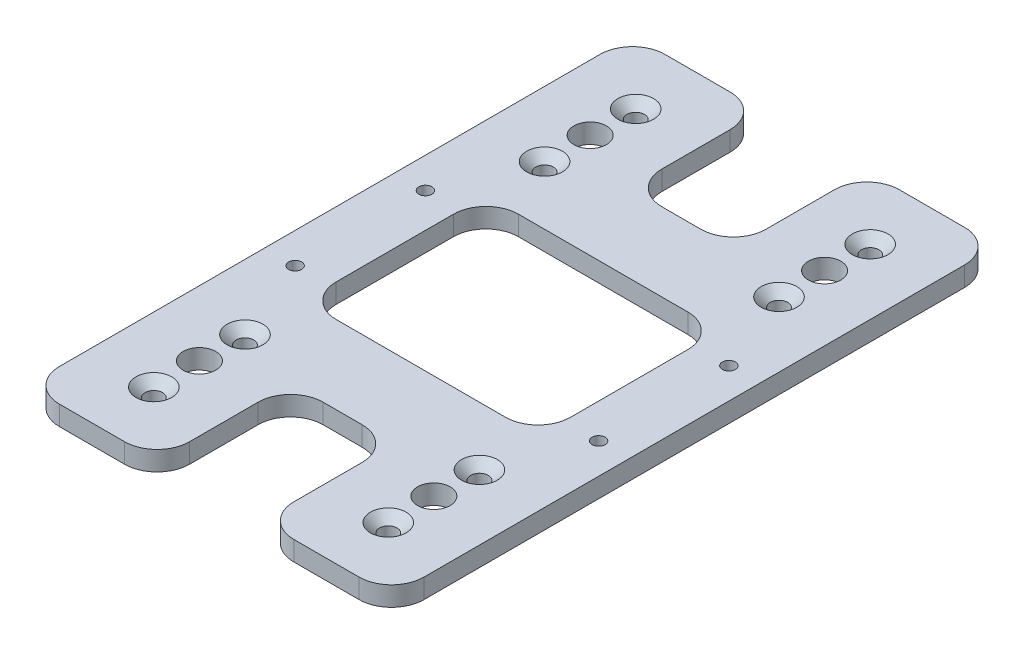
from build123d import *

# Parameters (mm, degrees)
BOSS_EXTRUDE1_DEPTH                                  = 3
FILLET1_R                                            = 5
CUT_EXTRUDE1_REACH                                   = 56.362
SKETCH5_W                                            = 36
SKETCH5_H                                            = 28
FILLET2_R                                            = 5
CSK_FOR_M2_5_COUNTERSUNK_FLAT_HEAD_SCREW_D           = 2.7
CSK_FOR_M2_5_COUNTERSUNK_FLAT_HEAD_SCREW_CSINK_D     = 5.5
CSK_FOR_M2_5_COUNTERSUNK_FLAT_HEAD_SCREW_CSINK_ANGLE = 90
CUT_EXTRUDE2_REACH                                   = 56.362
SKETCH3_R                                            = 2.5
MIRROR1_AT_THE_SECOND_PLANE_COPY_1_D                 = 2.7
MIRROR1_AT_THE_SECOND_PLANE_COPY_1_CSINK_D           = 5.5
MIRROR1_AT_THE_SECOND_PLANE_COPY_1_CSINK_ANGLE       = 90
MIRROR1_AT_THE_SECOND_PLANE_COPY_2_REACH             = 56.362
MIRROR1_AT_THE_SECOND_PLANE_COPY_2_SKETC_R           = 2.5
CUT_EXTRUDE3_REACH                                   = 56.362
SKETCH7_R                                            = 1
MIRROR2_AT_THE_SECOND_PLANE_COPY_1_REACH             = 56.362
MIRROR2_AT_THE_SECOND_PLANE_COPY_1_SKETC_R           = 1


with BuildPart() as part:
    # Sketch1 → Boss-Extrude1 (new body)
    with BuildSketch(Plane(origin=(0, 0, 0), x_dir=(1, 0, 0), z_dir=(0, 1, 0))):
        Polygon((8, 26), (-8, 26), (-8, 46.5), (-28, 46.5), (-28, -46.5), (-8, -46.5), (-8, -26), (8, -26), (8, -46.5), (28, -46.5), (28, 46.5), (8, 46.5), align=None)
    extrude(amount=BOSS_EXTRUDE1_DEPTH)

    # Fillet1
    fillet1_edges = [part.edges().sort_by_distance(p)[0] for p in [
        (-8, 1.5, -26),
        (8, 1.5, -26),
        (8, 1.5, -46.5),
        (28, 1.5, -46.5),
        (28, 1.5, 46.5),
        (8, 1.5, 46.5),
        (8, 1.5, 26),
        (-8, 1.5, 26),
        (-8, 1.5, 46.5),
        (-28, 1.5, 46.5),
        (-28, 1.5, -46.5),
        (-8, 1.5, -46.5),
    ]]
    fillet(fillet1_edges, radius=FILLET1_R)

    # Sketch5 → Cut-Extrude1 (cut, up to next)
    with BuildSketch(Plane(origin=(0, 3, 0), x_dir=(1, 0, 0), z_dir=(0, 1, 0)), mode=Mode.PRIVATE) as cut_extrude1_sk1:
        Rectangle(SKETCH5_W, SKETCH5_H)
    cut_extrude1_tool1 = extrude(cut_extrude1_sk1.sketch, amount=-CUT_EXTRUDE1_REACH, mode=Mode.PRIVATE) & part.part
    add(cut_extrude1_tool1.solids().sort_by_distance((0, 3, 0))[0], mode=Mode.SUBTRACT)

    # Fillet2
    fillet2_edges = [part.edges().sort_by_distance(p)[0] for p in [
        (-18, 1.5, 14),
        (-18, 1.5, -14),
        (18, 1.5, -14),
        (18, 1.5, 14),
    ]]
    fillet(fillet2_edges, radius=FILLET2_R)

    # CSK for M2.5 Countersunk Flat Head Screw1 (through all)
    with Locations(Plane(origin=(-18, 3, -37), x_dir=(0, 0, 1), z_dir=(0, 1, 0))):
        with Locations((0, 0), (14, 0)):
            csk_for_m2_5_countersunk_flat_head_screw = CounterSinkHole(CSK_FOR_M2_5_COUNTERSUNK_FLAT_HEAD_SCREW_D / 2, CSK_FOR_M2_5_COUNTERSUNK_FLAT_HEAD_SCREW_CSINK_D / 2, counter_sink_angle=CSK_FOR_M2_5_COUNTERSUNK_FLAT_HEAD_SCREW_CSINK_ANGLE)

    # Sketch3 → Cut-Extrude2 (cut, up to next)
    with BuildSketch(Plane(origin=(0, 3, 0), x_dir=(1, 0, 0), z_dir=(0, 1, 0)), mode=Mode.PRIVATE) as cut_extrude2_sk1:
        with Locations(Location((-18, 30, 0), (0, 0, 270))):
            Circle(SKETCH3_R)
    cut_extrude2_tool1 = extrude(cut_extrude2_sk1.sketch, amount=-CUT_EXTRUDE2_REACH, mode=Mode.PRIVATE) & part.part
    cut_extrude2 = cut_extrude2_tool1.solids().sort_by_distance((-18, 3, -30))[0]
    add(cut_extrude2, mode=Mode.SUBTRACT)

    # Mirror1: CSK for M2.5 Countersunk Flat Head Screw1, Cut-Extrude2 across plane
    add(csk_for_m2_5_countersunk_flat_head_screw.mirror(Plane(origin=(0, 0, 0), x_dir=(0, 0, 1), z_dir=(1, 0, 0))), mode=Mode.SUBTRACT)
    add(cut_extrude2.mirror(Plane(origin=(0, 0, 0), x_dir=(0, 0, 1), z_dir=(1, 0, 0))), mode=Mode.SUBTRACT)

    # Mirror1 at the second plane: CSK for M2.5 Countersunk Flat Head Screw1, Cut-Extrude2 across plane
    add(csk_for_m2_5_countersunk_flat_head_screw.mirror(Plane.XY), mode=Mode.SUBTRACT)
    add(cut_extrude2.mirror(Plane.XY), mode=Mode.SUBTRACT)

    # Mirror1 at the second plane copy 1 (through all)
    with Locations(Plane(origin=(18, 3, 37), x_dir=(0, 0, -1), z_dir=(0, 1, 0))):
        with Locations((0, 0), (14, 0)):
            CounterSinkHole(MIRROR1_AT_THE_SECOND_PLANE_COPY_1_D / 2, MIRROR1_AT_THE_SECOND_PLANE_COPY_1_CSINK_D / 2, counter_sink_angle=MIRROR1_AT_THE_SECOND_PLANE_COPY_1_CSINK_ANGLE)

    # Mirror1 at the second plane copy 2 sketc → Mirror1 at the second plane copy 2 (cut, up to next)
    with BuildSketch(Plane(origin=(0, 3, 0), x_dir=(-1, 0, 0), z_dir=(0, 1, 0)), mode=Mode.PRIVATE) as mirror1_at_the_second_plane_copy_2_sk1:
        with Locations(Location((-18, 30, 0), (0, 0, 270))):
            Circle(MIRROR1_AT_THE_SECOND_PLANE_COPY_2_SKETC_R)
    mirror1_at_the_second_plane_copy_2_tool1 = extrude(mirror1_at_the_second_plane_copy_2_sk1.sketch, amount=-MIRROR1_AT_THE_SECOND_PLANE_COPY_2_REACH, mode=Mode.PRIVATE) & part.part
    add(mirror1_at_the_second_plane_copy_2_tool1.solids().sort_by_distance((18, 3, 30))[0], mode=Mode.SUBTRACT)

    # Sketch7 → Cut-Extrude3 (cut, up to next)
    with BuildSketch(Plane(origin=(0, 3, 0), x_dir=(1, 0, 0), z_dir=(0, 1, 0)), mode=Mode.PRIVATE) as cut_extrude3_sk1:
        with Locations(Location((-23.3, 10, 0), (0, 0, 270))):
            Circle(SKETCH7_R)
    cut_extrude3_tool1 = extrude(cut_extrude3_sk1.sketch, amount=-CUT_EXTRUDE3_REACH, mode=Mode.PRIVATE) & part.part
    cut_extrude3 = cut_extrude3_tool1.solids().sort_by_distance((-23.3, 3, -10))[0]
    add(cut_extrude3, mode=Mode.SUBTRACT)

    # Mirror2: Cut-Extrude3 across plane
    add(cut_extrude3.mirror(Plane(origin=(0, 0, 0), x_dir=(0, 0, 1), z_dir=(1, 0, 0))), mode=Mode.SUBTRACT)

    # Mirror2 at the second plane: Cut-Extrude3 across plane
    add(cut_extrude3.mirror(Plane.XY), mode=Mode.SUBTRACT)

    # Mirror2 at the second plane copy 1 sketc → Mirror2 at the second plane copy 1 (cut, up to next)
    with BuildSketch(Plane(origin=(0, 3, 0), x_dir=(-1, 0, 0), z_dir=(0, 1, 0)), mode=Mode.PRIVATE) as mirror2_at_the_second_plane_copy_1_sk1:
        with Locations(Location((-23.3, 10, 0), (0, 0, 270))):
            Circle(MIRROR2_AT_THE_SECOND_PLANE_COPY_1_SKETC_R)
    mirror2_at_the_second_plane_copy_1_tool1 = extrude(mirror2_at_the_second_plane_copy_1_sk1.sketch, amount=-MIRROR2_AT_THE_SECOND_PLANE_COPY_1_REACH, mode=Mode.PRIVATE) & part.part
    add(mirror2_at_the_second_plane_copy_1_tool1.solids().sort_by_distance((23.3, 3, 10))[0], mode=Mode.SUBTRACT)


solid = part.part
